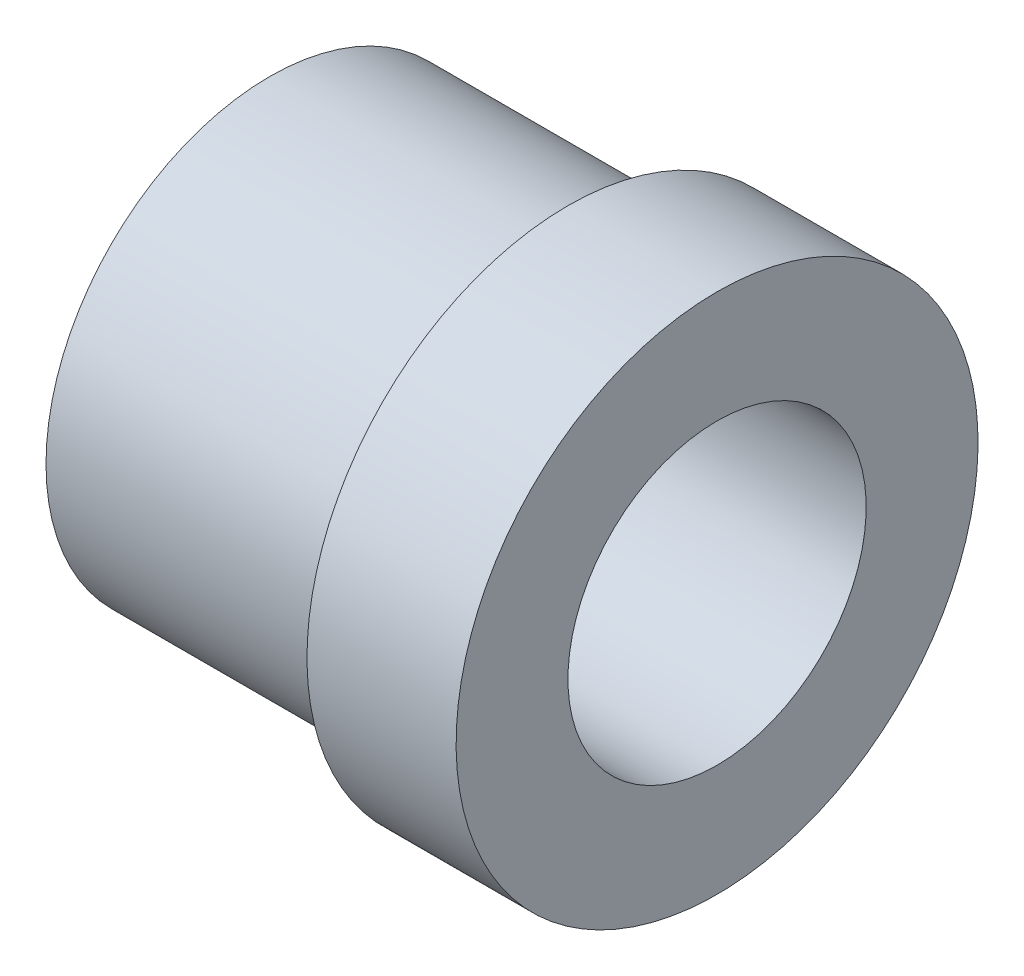
from build123d import *

# Parameters (mm, degrees)
SKETCH3_R          = 2
CUT_EXTRUDE1_DEPTH = 8.778174593


with BuildPart() as part:
    # Sketch2 → Revolve1 (revolve)
    with BuildSketch(Plane.XY):
        Polygon((-6, 0), (-6, 3), (-2, 3), (-2, 3.5), (0, 3.5), (0, 0), align=None)
    revolve(axis=Axis((0, 0, 0), (-1, 0, 0)))

    # Sketch3 → Cut-Extrude1 (cut, through all)
    with BuildSketch(Plane(origin=(0, 0, 0), x_dir=(0, 0, -1), z_dir=(1, 0, 0))):
        with Locations(Location((0, 0, 0), (0, 0, 90))):
            Circle(SKETCH3_R)
    extrude(amount=-CUT_EXTRUDE1_DEPTH, mode=Mode.SUBTRACT)


solid = part.part
